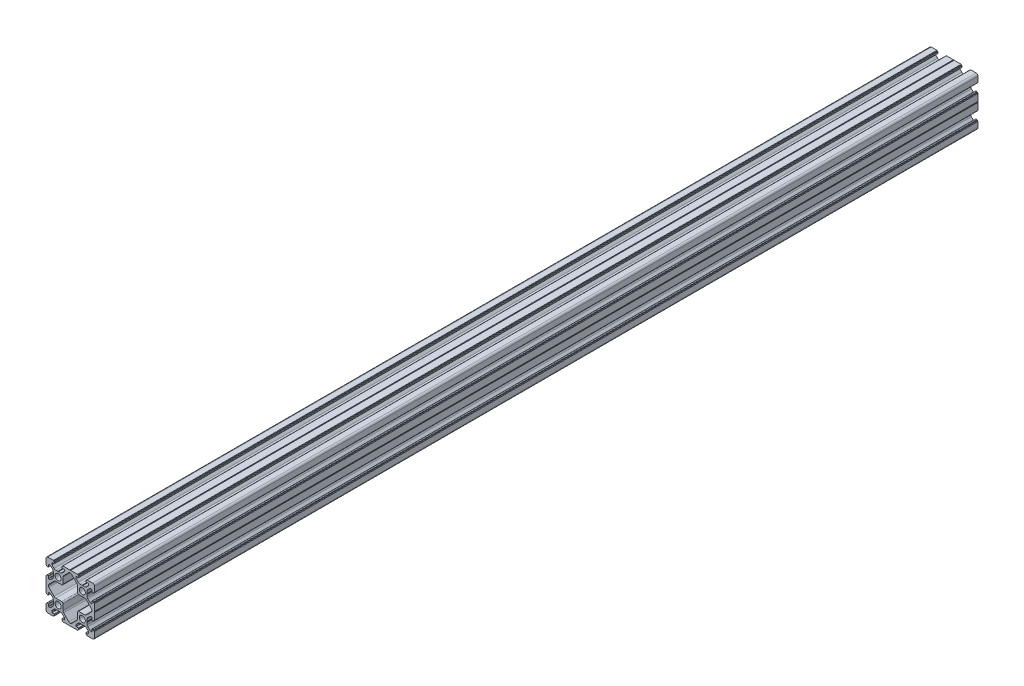
from build123d import *

# Parameters (mm, degrees)
EXTRUDE_2_DEPTH = 730


with BuildPart() as part:
    # Эскиз3 → Бобышка-Вытянуть2 (new body)
    with BuildSketch(Plane.XY):
        with BuildLine():
            Line((0.23701886, 19.958012574), (0, 19.8))
            Line((0, 19.8), (-0.23701886, 19.958012574))
            ThreePointArc((-0.23701886, 19.958012574), (-0.303247872, 19.989273007), (-0.375693909, 20))
            Line((-0.375693909, 20), (-6.05, 20))
            ThreePointArc((-6.05, 20), (-6.226776695, 19.926776695), (-6.3, 19.75))
            Line((-6.3, 19.75), (-6.3, 19.4))
            Line((-6.3, 19.4), (-6.68, 19.4))
            ThreePointArc((-6.68, 19.4), (-6.856776695, 19.326776695), (-6.93, 19.15))
            Line((-6.93, 19.15), (-6.93, 18.25))
            ThreePointArc((-6.93, 18.25), (-6.856776695, 18.073223305), (-6.68, 18))
            Line((-6.68, 18), (-5, 18))
            ThreePointArc((-5, 18), (-4.858578644, 17.941421356), (-4.8, 17.8))
            Line((-4.8, 17.8), (-4.8, 16.851650429))
            ThreePointArc((-4.8, 16.851650429), (-4.876120467, 16.468966997), (-5.092893219, 16.144543648))
            Line((-5.092893219, 16.144543648), (-6.651650429, 14.585786438))
            ThreePointArc((-6.651650429, 14.585786438), (-7.300497127, 14.152240935), (-8.065863992, 14))
            Line((-8.065863992, 14), (-9.662304735, 14))
            ThreePointArc((-9.662304735, 14), (-9.745056471, 13.98590708), (-9.818478497, 13.945217202))
            Line((-9.818478497, 13.945217202), (-10, 13.8))
            Line((-10, 13.8), (-10.181521503, 13.945217202))
            ThreePointArc((-10.181521503, 13.945217202), (-10.254943529, 13.98590708), (-10.337695265, 14))
            Line((-10.337695265, 14), (-11.934136008, 14))
            ThreePointArc((-11.934136008, 14), (-12.699502873, 14.152240935), (-13.348349571, 14.585786438))
            Line((-13.348349571, 14.585786438), (-14.907106781, 16.144543648))
            ThreePointArc((-14.907106781, 16.144543648), (-15.123879533, 16.468966997), (-15.2, 16.851650429))
            Line((-15.2, 16.851650429), (-15.2, 17.8))
            ThreePointArc((-15.2, 17.8), (-15.141421356, 17.941421356), (-15, 18))
            Line((-15, 18), (-13.32, 18))
            ThreePointArc((-13.32, 18), (-13.143223305, 18.073223305), (-13.07, 18.25))
            Line((-13.07, 18.25), (-13.07, 19.15))
            ThreePointArc((-13.07, 19.15), (-13.143223305, 19.326776695), (-13.32, 19.4))
            Line((-13.32, 19.4), (-13.7, 19.4))
            Line((-13.7, 19.4), (-13.7, 19.75))
            ThreePointArc((-13.7, 19.75), (-13.773223305, 19.926776695), (-13.95, 20))
            Line((-13.95, 20), (-18.5, 20))
            ThreePointArc((-18.5, 20), (-19.560660172, 19.560660172), (-20, 18.5))
            Line((-20, 18.5), (-20, 13.95))
            ThreePointArc((-20, 13.95), (-19.926776695, 13.773223305), (-19.75, 13.7))
            Line((-19.75, 13.7), (-19.4, 13.7))
            Line((-19.4, 13.7), (-19.4, 13.32))
            ThreePointArc((-19.4, 13.32), (-19.326776695, 13.143223305), (-19.15, 13.07))
            Line((-19.15, 13.07), (-18.25, 13.07))
            ThreePointArc((-18.25, 13.07), (-18.073223305, 13.143223305), (-18, 13.32))
            Line((-18, 13.32), (-18, 15))
            ThreePointArc((-18, 15), (-17.941421356, 15.141421356), (-17.8, 15.2))
            Line((-17.8, 15.2), (-16.851650429, 15.2))
            ThreePointArc((-16.851650429, 15.2), (-16.468966997, 15.123879533), (-16.144543648, 14.907106781))
            Line((-16.144543648, 14.907106781), (-14.585786438, 13.348349571))
            ThreePointArc((-14.585786438, 13.348349571), (-14.152240935, 12.699502873), (-14, 11.934136008))
            Line((-14, 11.934136008), (-14, 10.337695265))
            ThreePointArc((-14, 10.337695265), (-13.98590708, 10.254943529), (-13.945217202, 10.181521503))
            Line((-13.945217202, 10.181521503), (-13.8, 10))
            Line((-13.8, 10), (-13.945217202, 9.818478497))
            ThreePointArc((-13.945217202, 9.818478497), (-13.98590708, 9.745056471), (-14, 9.662304735))
            Line((-14, 9.662304735), (-14, 8.065863992))
            ThreePointArc((-14, 8.065863992), (-14.152240935, 7.300497127), (-14.585786438, 6.651650429))
            Line((-14.585786438, 6.651650429), (-16.144543648, 5.092893219))
            ThreePointArc((-16.144543648, 5.092893219), (-16.468966997, 4.876120467), (-16.851650429, 4.8))
            Line((-16.851650429, 4.8), (-17.8, 4.8))
            ThreePointArc((-17.8, 4.8), (-17.941421356, 4.858578644), (-18, 5))
            Line((-18, 5), (-18, 6.68))
            ThreePointArc((-18, 6.68), (-18.073223305, 6.856776695), (-18.25, 6.93))
            Line((-18.25, 6.93), (-19.15, 6.93))
            ThreePointArc((-19.15, 6.93), (-19.326776695, 6.856776695), (-19.4, 6.68))
            Line((-19.4, 6.68), (-19.4, 6.3))
            Line((-19.4, 6.3), (-19.75, 6.3))
            ThreePointArc((-19.75, 6.3), (-19.926776695, 6.226776695), (-20, 6.05))
            Line((-20, 6.05), (-20, 0.375693909))
            ThreePointArc((-20, 0.375693909), (-19.989273007, 0.303247872), (-19.958012574, 0.23701886))
            Line((-19.958012574, 0.23701886), (-19.8, 0))
            Line((-19.8, 0), (-19.958012574, -0.23701886))
            ThreePointArc((-19.958012574, -0.23701886), (-19.989273007, -0.303247872), (-20, -0.375693909))
            Line((-20, -0.375693909), (-20, -6.05))
            ThreePointArc((-20, -6.05), (-19.926776695, -6.226776695), (-19.75, -6.3))
            Line((-19.75, -6.3), (-19.4, -6.3))
            Line((-19.4, -6.3), (-19.4, -6.68))
            ThreePointArc((-19.4, -6.68), (-19.326776695, -6.856776695), (-19.15, -6.93))
            Line((-19.15, -6.93), (-18.25, -6.93))
            ThreePointArc((-18.25, -6.93), (-18.073223305, -6.856776695), (-18, -6.68))
            Line((-18, -6.68), (-18, -5))
            ThreePointArc((-18, -5), (-17.941421356, -4.858578644), (-17.8, -4.8))
            Line((-17.8, -4.8), (-16.851650429, -4.8))
            ThreePointArc((-16.851650429, -4.8), (-16.468966997, -4.876120467), (-16.144543648, -5.092893219))
            Line((-16.144543648, -5.092893219), (-14.585786438, -6.651650429))
            ThreePointArc((-14.585786438, -6.651650429), (-14.152240935, -7.300497127), (-14, -8.065863992))
            Line((-14, -8.065863992), (-14, -9.662304735))
            ThreePointArc((-14, -9.662304735), (-13.98590708, -9.745056471), (-13.945217202, -9.818478497))
            Line((-13.945217202, -9.818478497), (-13.8, -10))
            Line((-13.8, -10), (-13.945217202, -10.181521503))
            ThreePointArc((-13.945217202, -10.181521503), (-13.98590708, -10.254943529), (-14, -10.337695265))
            Line((-14, -10.337695265), (-14, -11.934136008))
            ThreePointArc((-14, -11.934136008), (-14.152240935, -12.699502873), (-14.585786438, -13.348349571))
            Line((-14.585786438, -13.348349571), (-16.144543648, -14.907106781))
            ThreePointArc((-16.144543648, -14.907106781), (-16.468966997, -15.123879533), (-16.851650429, -15.2))
            Line((-16.851650429, -15.2), (-17.8, -15.2))
            ThreePointArc((-17.8, -15.2), (-17.941421356, -15.141421356), (-18, -15))
            Line((-18, -15), (-18, -13.32))
            ThreePointArc((-18, -13.32), (-18.073223305, -13.143223305), (-18.25, -13.07))
            Line((-18.25, -13.07), (-19.15, -13.07))
            ThreePointArc((-19.15, -13.07), (-19.326776695, -13.143223305), (-19.4, -13.32))
            Line((-19.4, -13.32), (-19.4, -13.7))
            Line((-19.4, -13.7), (-19.75, -13.7))
            ThreePointArc((-19.75, -13.7), (-19.926776695, -13.773223305), (-20, -13.95))
            Line((-20, -13.95), (-20, -18.5))
            ThreePointArc((-20, -18.5), (-19.560660172, -19.560660172), (-18.5, -20))
            Line((-18.5, -20), (-13.95, -20))
            ThreePointArc((-13.95, -20), (-13.773223305, -19.926776695), (-13.7, -19.75))
            Line((-13.7, -19.75), (-13.7, -19.4))
            Line((-13.7, -19.4), (-13.32, -19.4))
            ThreePointArc((-13.32, -19.4), (-13.143223305, -19.326776695), (-13.07, -19.15))
            Line((-13.07, -19.15), (-13.07, -18.25))
            ThreePointArc((-13.07, -18.25), (-13.143223305, -18.073223305), (-13.32, -18))
            Line((-13.32, -18), (-15, -18))
            ThreePointArc((-15, -18), (-15.141421356, -17.941421356), (-15.2, -17.8))
            Line((-15.2, -17.8), (-15.2, -16.851650429))
            ThreePointArc((-15.2, -16.851650429), (-15.123879533, -16.468966997), (-14.907106781, -16.144543648))
            Line((-14.907106781, -16.144543648), (-13.348349571, -14.585786438))
            ThreePointArc((-13.348349571, -14.585786438), (-12.699502873, -14.152240935), (-11.934136008, -14))
            Line((-11.934136008, -14), (-10.337695265, -14))
            ThreePointArc((-10.337695265, -14), (-10.254943529, -13.98590708), (-10.181521503, -13.945217202))
            Line((-10.181521503, -13.945217202), (-10, -13.8))
            Line((-10, -13.8), (-9.818478497, -13.945217202))
            ThreePointArc((-9.818478497, -13.945217202), (-9.745056471, -13.98590708), (-9.662304735, -14))
            Line((-9.662304735, -14), (-8.065863992, -14))
            ThreePointArc((-8.065863992, -14), (-7.300497127, -14.152240935), (-6.651650429, -14.585786438))
            Line((-6.651650429, -14.585786438), (-5.092893219, -16.144543648))
            ThreePointArc((-5.092893219, -16.144543648), (-4.876120467, -16.468966997), (-4.8, -16.851650429))
            Line((-4.8, -16.851650429), (-4.8, -17.8))
            ThreePointArc((-4.8, -17.8), (-4.858578644, -17.941421356), (-5, -18))
            Line((-5, -18), (-6.68, -18))
            ThreePointArc((-6.68, -18), (-6.856776695, -18.073223305), (-6.93, -18.25))
            Line((-6.93, -18.25), (-6.93, -19.15))
            ThreePointArc((-6.93, -19.15), (-6.856776695, -19.326776695), (-6.68, -19.4))
            Line((-6.68, -19.4), (-6.3, -19.4))
            Line((-6.3, -19.4), (-6.3, -19.75))
            ThreePointArc((-6.3, -19.75), (-6.226776695, -19.926776695), (-6.05, -20))
            Line((-6.05, -20), (-0.375693909, -20))
            ThreePointArc((-0.375693909, -20), (-0.303247872, -19.989273007), (-0.23701886, -19.958012574))
            Line((-0.23701886, -19.958012574), (0, -19.8))
            Line((0, -19.8), (0.23701886, -19.958012574))
            ThreePointArc((0.23701886, -19.958012574), (0.303247872, -19.989273007), (0.375693909, -20))
            Line((0.375693909, -20), (6.05, -20))
            ThreePointArc((6.05, -20), (6.226776695, -19.926776695), (6.3, -19.75))
            Line((6.3, -19.75), (6.3, -19.4))
            Line((6.3, -19.4), (6.68, -19.4))
            ThreePointArc((6.68, -19.4), (6.856776695, -19.326776695), (6.93, -19.15))
            Line((6.93, -19.15), (6.93, -18.25))
            ThreePointArc((6.93, -18.25), (6.856776695, -18.073223305), (6.68, -18))
            Line((6.68, -18), (5, -18))
            ThreePointArc((5, -18), (4.858578644, -17.941421356), (4.8, -17.8))
            Line((4.8, -17.8), (4.8, -16.851650429))
            ThreePointArc((4.8, -16.851650429), (4.876120467, -16.468966997), (5.092893219, -16.144543648))
            Line((5.092893219, -16.144543648), (6.651650429, -14.585786438))
            ThreePointArc((6.651650429, -14.585786438), (7.300497127, -14.152240935), (8.065863992, -14))
            Line((8.065863992, -14), (9.662304735, -14))
            ThreePointArc((9.662304735, -14), (9.745056471, -13.98590708), (9.818478497, -13.945217202))
            Line((9.818478497, -13.945217202), (10, -13.8))
            Line((10, -13.8), (10.181521503, -13.945217202))
            ThreePointArc((10.181521503, -13.945217202), (10.254943529, -13.98590708), (10.337695265, -14))
            Line((10.337695265, -14), (11.934136008, -14))
            ThreePointArc((11.934136008, -14), (12.699502873, -14.152240935), (13.348349571, -14.585786438))
            Line((13.348349571, -14.585786438), (14.907106781, -16.144543648))
            ThreePointArc((14.907106781, -16.144543648), (15.123879533, -16.468966997), (15.2, -16.851650429))
            Line((15.2, -16.851650429), (15.2, -17.8))
            ThreePointArc((15.2, -17.8), (15.141421356, -17.941421356), (15, -18))
            Line((15, -18), (13.32, -18))
            ThreePointArc((13.32, -18), (13.143223305, -18.073223305), (13.07, -18.25))
            Line((13.07, -18.25), (13.07, -19.15))
            ThreePointArc((13.07, -19.15), (13.143223305, -19.326776695), (13.32, -19.4))
            Line((13.32, -19.4), (13.7, -19.4))
            Line((13.7, -19.4), (13.7, -19.75))
            ThreePointArc((13.7, -19.75), (13.773223305, -19.926776695), (13.95, -20))
            Line((13.95, -20), (18.5, -20))
            ThreePointArc((18.5, -20), (19.560660172, -19.560660172), (20, -18.5))
            Line((20, -18.5), (20, -13.95))
            ThreePointArc((20, -13.95), (19.926776695, -13.773223305), (19.75, -13.7))
            Line((19.75, -13.7), (19.4, -13.7))
            Line((19.4, -13.7), (19.4, -13.32))
            ThreePointArc((19.4, -13.32), (19.326776695, -13.143223305), (19.15, -13.07))
            Line((19.15, -13.07), (18.25, -13.07))
            ThreePointArc((18.25, -13.07), (18.073223305, -13.143223305), (18, -13.32))
            Line((18, -13.32), (18, -15))
            ThreePointArc((18, -15), (17.941421356, -15.141421356), (17.8, -15.2))
            Line((17.8, -15.2), (16.851650429, -15.2))
            ThreePointArc((16.851650429, -15.2), (16.468966997, -15.123879533), (16.144543648, -14.907106781))
            Line((16.144543648, -14.907106781), (14.585786438, -13.348349571))
            ThreePointArc((14.585786438, -13.348349571), (14.152240935, -12.699502873), (14, -11.934136008))
            Line((14, -11.934136008), (14, -10.337695265))
            ThreePointArc((14, -10.337695265), (13.98590708, -10.254943529), (13.945217202, -10.181521503))
            Line((13.945217202, -10.181521503), (13.8, -10))
            Line((13.8, -10), (13.945217202, -9.818478497))
            ThreePointArc((13.945217202, -9.818478497), (13.98590708, -9.745056471), (14, -9.662304735))
            Line((14, -9.662304735), (14, -8.065863992))
            ThreePointArc((14, -8.065863992), (14.152240935, -7.300497127), (14.585786438, -6.651650429))
            Line((14.585786438, -6.651650429), (16.144543648, -5.092893219))
            ThreePointArc((16.144543648, -5.092893219), (16.468966997, -4.876120467), (16.851650429, -4.8))
            Line((16.851650429, -4.8), (17.8, -4.8))
            ThreePointArc((17.8, -4.8), (17.941421356, -4.858578644), (18, -5))
            Line((18, -5), (18, -6.68))
            ThreePointArc((18, -6.68), (18.073223305, -6.856776695), (18.25, -6.93))
            Line((18.25, -6.93), (19.15, -6.93))
            ThreePointArc((19.15, -6.93), (19.326776695, -6.856776695), (19.4, -6.68))
            Line((19.4, -6.68), (19.4, -6.3))
            Line((19.4, -6.3), (19.75, -6.3))
            ThreePointArc((19.75, -6.3), (19.926776695, -6.226776695), (20, -6.05))
            Line((20, -6.05), (20, -0.375693909))
            ThreePointArc((20, -0.375693909), (19.989273007, -0.303247872), (19.958012574, -0.23701886))
            Line((19.958012574, -0.23701886), (19.8, 0))
            Line((19.8, 0), (19.958012574, 0.23701886))
            ThreePointArc((19.958012574, 0.23701886), (19.989273007, 0.303247872), (20, 0.375693909))
            Line((20, 0.375693909), (20, 6.05))
            ThreePointArc((20, 6.05), (19.926776695, 6.226776695), (19.75, 6.3))
            Line((19.75, 6.3), (19.4, 6.3))
            Line((19.4, 6.3), (19.4, 6.68))
            ThreePointArc((19.4, 6.68), (19.326776695, 6.856776695), (19.15, 6.93))
            Line((19.15, 6.93), (18.25, 6.93))
            ThreePointArc((18.25, 6.93), (18.073223305, 6.856776695), (18, 6.68))
            Line((18, 6.68), (18, 5))
            ThreePointArc((18, 5), (17.941421356, 4.858578644), (17.8, 4.8))
            Line((17.8, 4.8), (16.851650429, 4.8))
            ThreePointArc((16.851650429, 4.8), (16.468966997, 4.876120467), (16.144543648, 5.092893219))
            Line((16.144543648, 5.092893219), (14.585786438, 6.651650429))
            ThreePointArc((14.585786438, 6.651650429), (14.152240935, 7.300497127), (14, 8.065863992))
            Line((14, 8.065863992), (14, 9.662304735))
            ThreePointArc((14, 9.662304735), (13.98590708, 9.745056471), (13.945217202, 9.818478497))
            Line((13.945217202, 9.818478497), (13.8, 10))
            Line((13.8, 10), (13.945217202, 10.181521503))
            ThreePointArc((13.945217202, 10.181521503), (13.98590708, 10.254943529), (14, 10.337695265))
            Line((14, 10.337695265), (14, 11.934136008))
            ThreePointArc((14, 11.934136008), (14.152240935, 12.699502873), (14.585786438, 13.348349571))
            Line((14.585786438, 13.348349571), (16.144543648, 14.907106781))
            ThreePointArc((16.144543648, 14.907106781), (16.468966997, 15.123879533), (16.851650429, 15.2))
            Line((16.851650429, 15.2), (17.8, 15.2))
            ThreePointArc((17.8, 15.2), (17.941421356, 15.141421356), (18, 15))
            Line((18, 15), (18, 13.32))
            ThreePointArc((18, 13.32), (18.073223305, 13.143223305), (18.25, 13.07))
            Line((18.25, 13.07), (19.15, 13.07))
            ThreePointArc((19.15, 13.07), (19.326776695, 13.143223305), (19.4, 13.32))
            Line((19.4, 13.32), (19.4, 13.7))
            Line((19.4, 13.7), (19.75, 13.7))
            ThreePointArc((19.75, 13.7), (19.926776695, 13.773223305), (20, 13.95))
            Line((20, 13.95), (20, 18.5))
            ThreePointArc((20, 18.5), (19.560660172, 19.560660172), (18.5, 20))
            Line((18.5, 20), (13.95, 20))
            ThreePointArc((13.95, 20), (13.773223305, 19.926776695), (13.7, 19.75))
            Line((13.7, 19.75), (13.7, 19.4))
            Line((13.7, 19.4), (13.32, 19.4))
            ThreePointArc((13.32, 19.4), (13.143223305, 19.326776695), (13.07, 19.15))
            Line((13.07, 19.15), (13.07, 18.25))
            ThreePointArc((13.07, 18.25), (13.143223305, 18.073223305), (13.32, 18))
            Line((13.32, 18), (15, 18))
            ThreePointArc((15, 18), (15.141421356, 17.941421356), (15.2, 17.8))
            Line((15.2, 17.8), (15.2, 16.851650429))
            ThreePointArc((15.2, 16.851650429), (15.123879533, 16.468966997), (14.907106781, 16.144543648))
            Line((14.907106781, 16.144543648), (13.348349571, 14.585786438))
            ThreePointArc((13.348349571, 14.585786438), (12.699502873, 14.152240935), (11.934136008, 14))
            Line((11.934136008, 14), (10.337695265, 14))
            ThreePointArc((10.337695265, 14), (10.254943529, 13.98590708), (10.181521503, 13.945217202))
            Line((10.181521503, 13.945217202), (10, 13.8))
            Line((10, 13.8), (9.818478497, 13.945217202))
            ThreePointArc((9.818478497, 13.945217202), (9.745056471, 13.98590708), (9.662304735, 14))
            Line((9.662304735, 14), (8.065863992, 14))
            ThreePointArc((8.065863992, 14), (7.300497127, 14.152240935), (6.651650429, 14.585786438))
            Line((6.651650429, 14.585786438), (5.092893219, 16.144543648))
            ThreePointArc((5.092893219, 16.144543648), (4.876120467, 16.468966997), (4.8, 16.851650429))
            Line((4.8, 16.851650429), (4.8, 17.8))
            ThreePointArc((4.8, 17.8), (4.858578644, 17.941421356), (5, 18))
            Line((5, 18), (6.68, 18))
            ThreePointArc((6.68, 18), (6.856776695, 18.073223305), (6.93, 18.25))
            Line((6.93, 18.25), (6.93, 19.15))
            ThreePointArc((6.93, 19.15), (6.856776695, 19.326776695), (6.68, 19.4))
            Line((6.68, 19.4), (6.3, 19.4))
            Line((6.3, 19.4), (6.3, 19.75))
            ThreePointArc((6.3, 19.75), (6.226776695, 19.926776695), (6.05, 20))
            Line((6.05, 20), (0.375693909, 20))
            ThreePointArc((0.375693909, 20), (0.303247872, 19.989273007), (0.23701886, 19.958012574))
        make_face()
        with BuildLine():
            Line((-7, 6), (-11.93019222, 6))
            ThreePointArc((-11.93019222, 6), (-12.698665826, 5.846469149), (-13.349155024, 5.409448318))
            Line((-13.349155024, 5.409448318), (-17.593273963, 1.136679437))
            ThreePointArc((-17.593273963, 1.136679437), (-17.894330628, 0.683646185), (-18, 0.150065614))
            Line((-18, 0.150065614), (-18, -0.150065614))
            ThreePointArc((-18, -0.150065614), (-17.894330628, -0.683646185), (-17.593273963, -1.136679437))
            Line((-17.593273963, -1.136679437), (-13.349155024, -5.409448318))
            ThreePointArc((-13.349155024, -5.409448318), (-12.698665826, -5.846469149), (-11.93019222, -6))
            Line((-11.93019222, -6), (-7, -6))
            ThreePointArc((-7, -6), (-6.292893219, -6.292893219), (-6, -7))
            Line((-6, -7), (-6, -11.93019222))
            ThreePointArc((-6, -11.93019222), (-5.846469149, -12.698665826), (-5.409448318, -13.349155024))
            Line((-5.409448318, -13.349155024), (-1.136679437, -17.593273963))
            ThreePointArc((-1.136679437, -17.593273963), (-0.683646185, -17.894330628), (-0.150065614, -18))
            Line((-0.150065614, -18), (0.150065614, -18))
            ThreePointArc((0.150065614, -18), (0.683646185, -17.894330628), (1.136679437, -17.593273963))
            Line((1.136679437, -17.593273963), (5.409448318, -13.349155024))
            ThreePointArc((5.409448318, -13.349155024), (5.846469149, -12.698665826), (6, -11.93019222))
            Line((6, -11.93019222), (6, -7))
            ThreePointArc((6, -7), (6.292893219, -6.292893219), (7, -6))
            Line((7, -6), (11.93019222, -6))
            ThreePointArc((11.93019222, -6), (12.698665826, -5.846469149), (13.349155024, -5.409448318))
            Line((13.349155024, -5.409448318), (17.593273963, -1.136679437))
            ThreePointArc((17.593273963, -1.136679437), (17.894330628, -0.683646185), (18, -0.150065614))
            Line((18, -0.150065614), (18, 0.150065614))
            ThreePointArc((18, 0.150065614), (17.894330628, 0.683646185), (17.593273963, 1.136679437))
            Line((17.593273963, 1.136679437), (13.349155024, 5.409448318))
            ThreePointArc((13.349155024, 5.409448318), (12.698665826, 5.846469149), (11.93019222, 6))
            Line((11.93019222, 6), (7, 6))
            ThreePointArc((7, 6), (6.292893219, 6.292893219), (6, 7))
            Line((6, 7), (6, 11.93019222))
            ThreePointArc((6, 11.93019222), (5.846469149, 12.698665826), (5.409448318, 13.349155024))
            Line((5.409448318, 13.349155024), (1.136679437, 17.593273963))
            ThreePointArc((1.136679437, 17.593273963), (0.683646185, 17.894330628), (0.150065614, 18))
            Line((0.150065614, 18), (-0.150065614, 18))
            ThreePointArc((-0.150065614, 18), (-0.683646185, 17.894330628), (-1.136679437, 17.593273963))
            Line((-1.136679437, 17.593273963), (-5.409448318, 13.349155024))
            ThreePointArc((-5.409448318, 13.349155024), (-5.846469149, 12.698665826), (-6, 11.93019222))
            Line((-6, 11.93019222), (-6, 7))
            ThreePointArc((-6, 7), (-6.292893219, 6.292893219), (-7, 6))
        make_face(mode=Mode.SUBTRACT)
        with BuildLine():
            ThreePointArc((7.5, 10), (10, 7.5), (12.5, 10))
            ThreePointArc((12.5, 10), (10, 12.5), (7.5, 10))
        make_face(mode=Mode.SUBTRACT)
        with BuildLine():
            ThreePointArc((-7.5, 10), (-10, 12.5), (-12.5, 10))
            ThreePointArc((-12.5, 10), (-10, 7.5), (-7.5, 10))
        make_face(mode=Mode.SUBTRACT)
        with BuildLine():
            ThreePointArc((-7.5, -10), (-10, -7.5), (-12.5, -10))
            ThreePointArc((-12.5, -10), (-10, -12.5), (-7.5, -10))
        make_face(mode=Mode.SUBTRACT)
        with BuildLine():
            ThreePointArc((12.5, -10), (10, -7.5), (7.5, -10))
            ThreePointArc((7.5, -10), (10, -12.5), (12.5, -10))
        make_face(mode=Mode.SUBTRACT)
    extrude(amount=EXTRUDE_2_DEPTH)


solid = part.part
